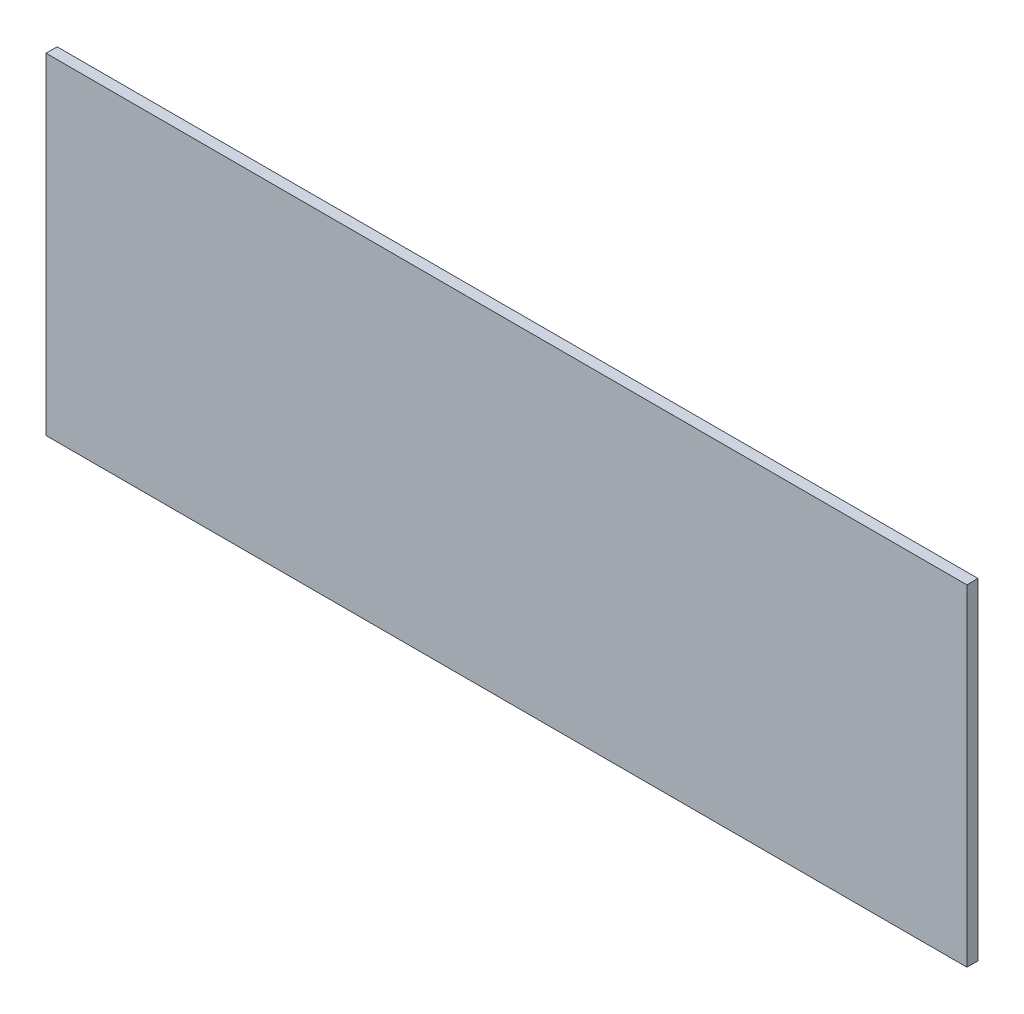
from build123d import *

# Parameters (mm, degrees)
SKETCH1_W           = 463.55
SKETCH1_H           = 166.6875
BOSS_EXTRUDE1_DEPTH = 5.588


with BuildPart() as part:
    # Sketch1 → Boss-Extrude1 (new body)
    with BuildSketch(Plane.XY):
        Rectangle(SKETCH1_W, SKETCH1_H)
    extrude(amount=BOSS_EXTRUDE1_DEPTH)


solid = part.part
